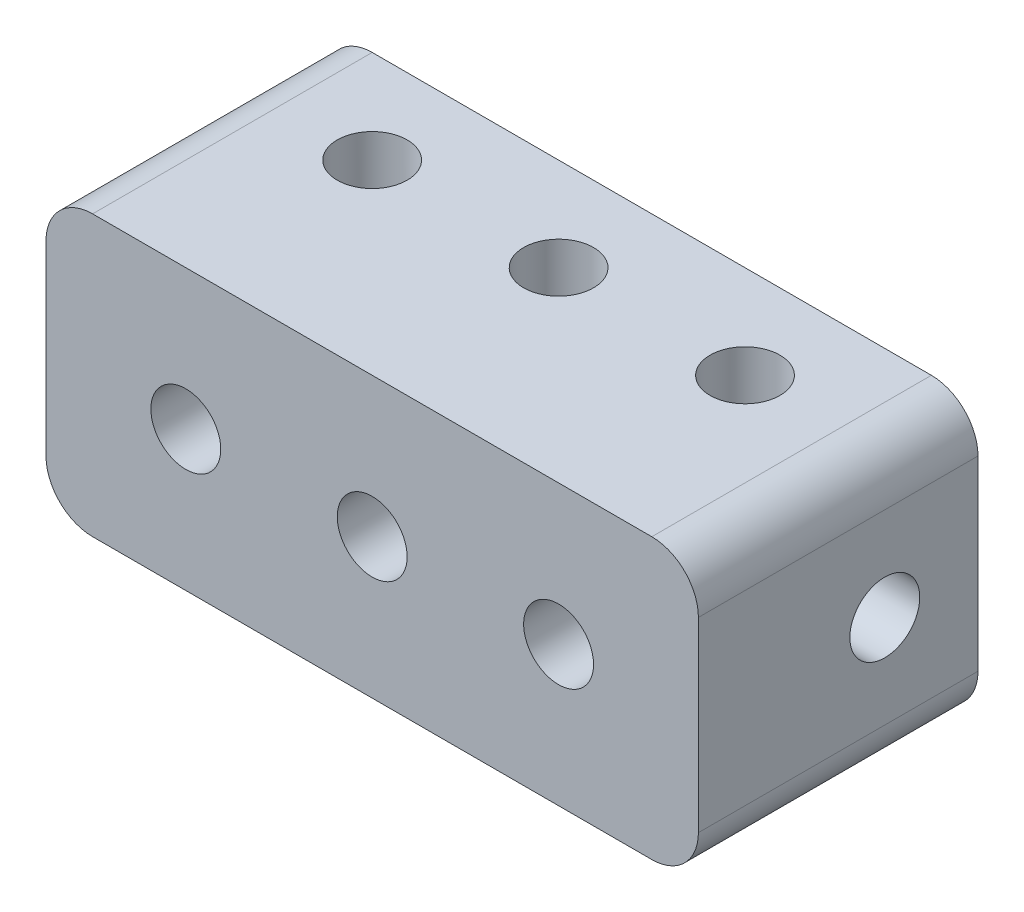
from build123d import *

# Parameters (mm, degrees)
BOSS_EXTRUDE1_DEPTH     = 19.05
CUT_EXTRUDE1_DEPTH      = 14.1224
CUT_EXTRUDE2_DEPTH      = 52.976990101
CUT_EXTRUDE2_DEPTH_BACK = 52.976990101
SKETCH4_R               = 2.38125
CUT_EXTRUDE3_DEPTH      = 52.976990138
CUT_EXTRUDE3_DEPTH_BACK = 52.976990138
SKETCH5_R               = 2.38125
CUT_EXTRUDE4_DEPTH      = 52.97699026
CUT_EXTRUDE4_DEPTH_BACK = 52.97699026
SKETCH7_R               = 2.38125


with BuildPart() as part:
    # Sketch2 → Boss-Extrude1 (new body)
    with BuildSketch(Plane.XY):
        with BuildLine():
            Line((3.175, 0), (41.275, 0))
            ThreePointArc((41.275, 0), (43.52006403, 0.92993597), (44.45, 3.175))
            Line((44.45, 3.175), (44.45, 15.875))
            ThreePointArc((44.45, 15.875), (43.52006403, 18.12006403), (41.275, 19.05))
            Line((41.275, 19.05), (3.175, 19.05))
            ThreePointArc((3.175, 19.05), (0.92993597, 18.12006403), (0, 15.875))
            Line((0, 15.875), (0, 3.175))
            ThreePointArc((0, 3.175), (0.92993597, 0.92993597), (3.175, 0))
        make_face()
    extrude(amount=BOSS_EXTRUDE1_DEPTH)

    # Sketch3 → Cut-Extrude1 (cut)
    with BuildSketch(Plane(origin=(0, 0, 0), x_dir=(-1, 0, 0), z_dir=(0, 0, -1))):
        with BuildLine():
            Line((-34.925, 14.2875), (-9.525, 14.2875))
            ThreePointArc((-9.525, 14.2875), (-4.7625, 9.525), (-9.525, 4.7625))
            Line((-9.525, 4.7625), (-34.925, 4.7625))
            ThreePointArc((-34.925, 4.7625), (-39.6875, 9.525), (-34.925, 14.2875))
        make_face()
    extrude(amount=-CUT_EXTRUDE1_DEPTH, mode=Mode.SUBTRACT)

    # Sketch4 → Cut-Extrude2 (cut, two sides: drawn at the far end of the back side and taken through both)
    with BuildSketch(Plane(origin=(0, 19.05, 0), x_dir=(1, 0, 0), z_dir=(0, 1, 0)).offset(-CUT_EXTRUDE2_DEPTH_BACK)):
        with Locations(Location((34.925, -6.35, 0), (0, 0, 270))):
            Circle(SKETCH4_R)
        with Locations(Location((22.225, -6.35, 0), (0, 0, 270))):
            Circle(SKETCH4_R)
        with Locations(Location((9.525, -6.35, 0), (0, 0, 270))):
            Circle(SKETCH4_R)
    extrude(amount=CUT_EXTRUDE2_DEPTH + CUT_EXTRUDE2_DEPTH_BACK, mode=Mode.SUBTRACT)

    # Sketch5 → Cut-Extrude3 (cut, two sides: drawn at the far end of the back side and taken through both)
    with BuildSketch(Plane(origin=(44.45, 0, 0), x_dir=(0, 0, -1), z_dir=(1, 0, 0)).offset(-CUT_EXTRUDE3_DEPTH_BACK)):
        with Locations((-6.35, 9.525)):
            Circle(SKETCH5_R)
    extrude(amount=CUT_EXTRUDE3_DEPTH + CUT_EXTRUDE3_DEPTH_BACK, mode=Mode.SUBTRACT)

    # Sketch7 → Cut-Extrude4 (cut, two sides: drawn at the far end of the back side and taken through both)
    with BuildSketch(Plane.XY.offset(19.05).offset(-CUT_EXTRUDE4_DEPTH_BACK)):
        with Locations((22.225, 9.525)):
            Circle(SKETCH7_R)
        with Locations((34.925, 9.525)):
            Circle(SKETCH7_R)
        with Locations((9.525, 9.525)):
            Circle(SKETCH7_R)
    extrude(amount=CUT_EXTRUDE4_DEPTH + CUT_EXTRUDE4_DEPTH_BACK, mode=Mode.SUBTRACT)


solid = part.part
